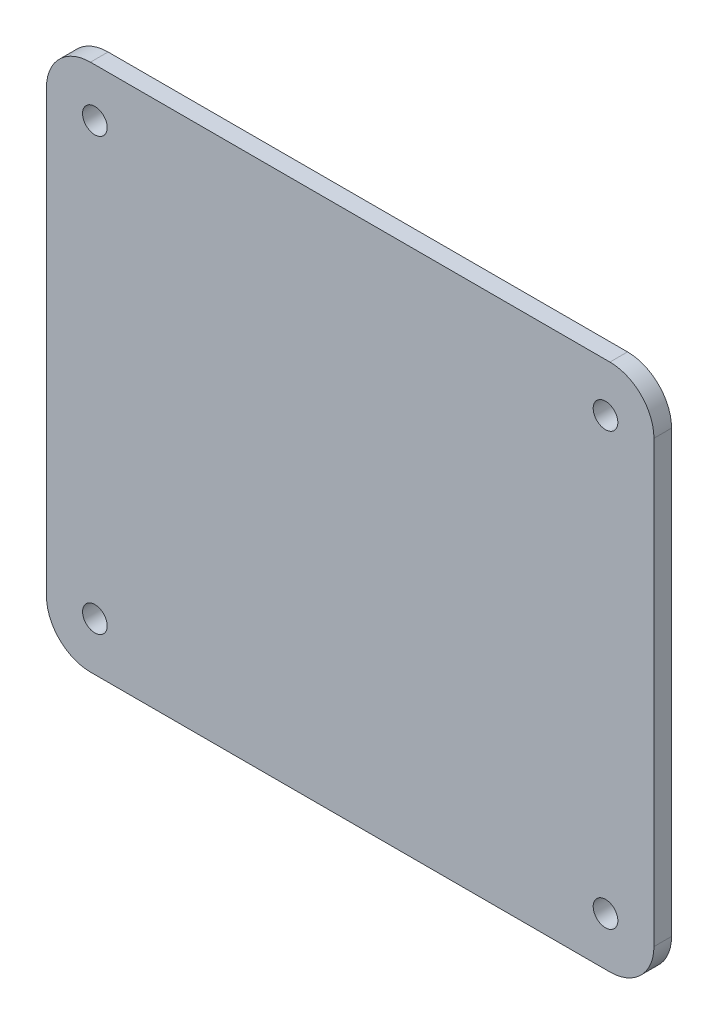
from build123d import *

# Parameters (mm, degrees)
BOSS_EXTRUDE1_DEPTH      = 6.5
SKETCH5_R                = 3
SKETCH5_R_2              = 1.4
BOSS_EXTRUDE5_DEPTH      = 3.2
BOSS_EXTRUDE5_2_DEPTH    = 3.2
BOSS_EXTRUDE5_3_DEPTH    = 3.2
BOSS_EXTRUDE5_4_DEPTH    = 3.2
BOSS_EXTRUDE6_START      = -1.5
BOSS_EXTRUDE6_DEPTH      = 1.5
CUT_EXTRUDE9_START       = -1.5
SKETCH17_R               = 1.4
CUT_EXTRUDE9_DEPTH       = 1.5
CUT_EXTRUDE10_DEPTH      = 10
CUT_EXTRUDE10_DEPTH_BACK = 4
SKETCH18_W               = 118.483225972
SKETCH18_H               = 113.092379331
SKETCH19_W               = 5
SKETCH19_H               = 5
BOSS_EXTRUDE9_DEPTH      = 7
SKETCH20_R               = 1.4
BOSS_EXTRUDE10_DEPTH     = 1.3


with BuildPart() as part:
    # Sketch3 → Boss-Extrude1 (new body)
    with BuildSketch(Plane.XY.offset(55.290865561)):
        with BuildLine():
            Line((-23.272824317, 59.357808031), (-23.272824317, 9.357808031))
            ThreePointArc((-23.272824317, 9.357808031), (-21.808358223, 5.822274126), (-18.272824317, 4.357808031))
            Line((-18.272824317, 4.357808031), (40.727175683, 4.357808031))
            ThreePointArc((40.727175683, 4.357808031), (44.262709589, 5.822274126), (45.727175683, 9.357808031))
            Line((45.727175683, 9.357808031), (45.727175683, 59.357808031))
            ThreePointArc((45.727175683, 59.357808031), (44.262709589, 62.893341937), (40.727175683, 64.357808031))
            Line((40.727175683, 64.357808031), (-18.272824317, 64.357808031))
            ThreePointArc((-18.272824317, 64.357808031), (-21.808358223, 62.893341937), (-23.272824317, 59.357808031))
        make_face()
        with BuildLine():
            Line((40.727175683, 62.857808031), (-18.272824317, 62.857808031))
            ThreePointArc((-18.272824317, 62.857808031), (-20.747698051, 61.832681766), (-21.772824317, 59.357808031))
            Line((-21.772824317, 59.357808031), (-21.772824317, 9.357808031))
            ThreePointArc((-21.772824317, 9.357808031), (-20.747698051, 6.882934297), (-18.272824317, 5.857808031))
            Line((-18.272824317, 5.857808031), (40.727175683, 5.857808031))
            ThreePointArc((40.727175683, 5.857808031), (43.202049418, 6.882934297), (44.227175683, 9.357808031))
            Line((44.227175683, 9.357808031), (44.227175683, 59.357808031))
            ThreePointArc((44.227175683, 59.357808031), (43.202049418, 61.832681766), (40.727175683, 62.857808031))
        make_face(mode=Mode.SUBTRACT)
    extrude(amount=BOSS_EXTRUDE1_DEPTH)



with BuildPart() as body_2:
    # Sketch5 → Boss-Extrude5 (new body)
    with BuildSketch(Plane.XY.offset(55.290865561)):
        with Locations((-17.772824317, 58.857808031)):
            Circle(SKETCH5_R)
        with Locations(Location((-17.772824317, 58.857808031, 0), (0, 0, 180))):
            Circle(SKETCH5_R_2, mode=Mode.SUBTRACT)
    extrude(amount=BOSS_EXTRUDE5_DEPTH)


with BuildPart() as body_3:
    # Sketch5 → Boss-Extrude5 2 (new body)
    with BuildSketch(Plane.XY.offset(55.290865561)):
        with Locations(Location((40.227175683, 58.857808031, 0), (0, 0, 180))):
            Circle(SKETCH5_R)
        with Locations((40.227175683, 58.857808031)):
            Circle(SKETCH5_R_2, mode=Mode.SUBTRACT)
    extrude(amount=BOSS_EXTRUDE5_2_DEPTH)


with BuildPart() as body_4:
    # Sketch5 → Boss-Extrude5 3 (new body)
    with BuildSketch(Plane.XY.offset(55.290865561)):
        with Locations(Location((-17.772824317, 9.857808031, 0), (0, 0, 180))):
            Circle(SKETCH5_R)
        with Locations((-17.772824317, 9.857808031)):
            Circle(SKETCH5_R_2, mode=Mode.SUBTRACT)
    extrude(amount=BOSS_EXTRUDE5_3_DEPTH)


with BuildPart() as body_5:
    # Sketch5 → Boss-Extrude5 4 (new body)
    with BuildSketch(Plane.XY.offset(55.290865561)):
        with Locations((40.227175683, 9.857808031)):
            Circle(SKETCH5_R)
        with Locations(Location((40.227175683, 9.857808031, 0), (0, 0, 180))):
            Circle(SKETCH5_R_2, mode=Mode.SUBTRACT)
    extrude(amount=BOSS_EXTRUDE5_4_DEPTH)


with BuildPart() as part_1:
    add(part.part)

    add(body_2.part)  # Boss-Extrude6 merges body 2

    add(body_3.part)  # Boss-Extrude6 merges body 3

    add(body_4.part)  # Boss-Extrude6 merges body 4

    add(body_5.part)  # Boss-Extrude6 merges body 5
    # Sketch13 → Boss-Extrude6 (add)
    with BuildSketch(Plane.XY.offset(55.290865561).offset(BOSS_EXTRUDE6_START)):
        with BuildLine():
            Line((-23.272824317, 26.657808031), (-23.272824317, 42.657808031))
            Line((-23.272824317, 42.657808031), (-23.272824317, 59.357808031))
            ThreePointArc((-23.272824317, 59.357808031), (-21.808358223, 62.893341937), (-18.272824317, 64.357808031))
            Line((-18.272824317, 64.357808031), (40.727175683, 64.357808031))
            ThreePointArc((40.727175683, 64.357808031), (44.262709589, 62.893341937), (45.727175683, 59.357808031))
            Line((45.727175683, 59.357808031), (45.727175683, 9.357808031))
            ThreePointArc((45.727175683, 9.357808031), (44.262709589, 5.822274126), (40.727175683, 4.357808031))
            Line((40.727175683, 4.357808031), (-18.272824317, 4.357808031))
            ThreePointArc((-18.272824317, 4.357808031), (-21.808358223, 5.822274126), (-23.272824317, 9.357808031))
            Line((-23.272824317, 9.357808031), (-23.272824317, 26.657808031))
        make_face()
    extrude(amount=BOSS_EXTRUDE6_DEPTH)

    # Sketch17 → Cut-Extrude9 (cut)
    with BuildSketch(Plane.XY.offset(55.290865561).offset(CUT_EXTRUDE9_START)):
        with Locations(Location((40.227175683, 9.857808031, 0), (0, 0, 180))):
            Circle(SKETCH17_R)
        with Locations(Location((-17.772824317, 9.857808031, 0), (0, 0, 180))):
            Circle(SKETCH17_R)
        with Locations(Location((-17.772824317, 58.857808031, 0), (0, 0, 180))):
            Circle(SKETCH17_R)
        with Locations(Location((40.227175683, 58.857808031, 0), (0, 0, 180))):
            Circle(SKETCH17_R)
    extrude(amount=CUT_EXTRUDE9_DEPTH, mode=Mode.SUBTRACT)

    # Sketch18 → Cut-Extrude10 (cut, two sides: drawn at the far end of the back side and taken through both)
    with BuildSketch(Plane.XY.offset(58.490865561).offset(-CUT_EXTRUDE10_DEPTH_BACK)):
        with Locations((8.738192824, 45.025275568)):
            Rectangle(SKETCH18_W, SKETCH18_H)
    extrude(amount=CUT_EXTRUDE10_DEPTH + CUT_EXTRUDE10_DEPTH_BACK, mode=Mode.SUBTRACT)

    # Sketch19 → Boss-Extrude9 (add)
    with BuildSketch(Plane(origin=(0, 0, 53.790865561), x_dir=(-1, 0, 0), z_dir=(0, 0, -1))):
        with Locations((-33.227175683, 51.857808031)):
            Rectangle(SKETCH19_W, SKETCH19_H)
        with Locations((10.772824317, 16.857808031)):
            Rectangle(SKETCH19_W, SKETCH19_H)
        with Locations((10.772824317, 51.857808031)):
            Rectangle(SKETCH19_W, SKETCH19_H)
        with Locations((-33.227175683, 16.857808031)):
            Rectangle(SKETCH19_W, SKETCH19_H)
    extrude(amount=BOSS_EXTRUDE9_DEPTH)

    # Sketch20 → Boss-Extrude10 (add)
    with BuildSketch(Plane.XY.offset(54.490865561)):
        with BuildLine():
            Line((40.727175683, 64.357808031), (-18.272824317, 64.357808031))
            ThreePointArc((-18.272824317, 64.357808031), (-21.808358223, 62.893341937), (-23.272824317, 59.357808031))
            Line((-23.272824317, 59.357808031), (-23.272824317, 9.357808031))
            ThreePointArc((-23.272824317, 9.357808031), (-21.808358223, 5.822274126), (-18.272824317, 4.357808031))
            Line((-18.272824317, 4.357808031), (40.727175683, 4.357808031))
            ThreePointArc((40.727175683, 4.357808031), (44.262709589, 5.822274126), (45.727175683, 9.357808031))
            Line((45.727175683, 9.357808031), (45.727175683, 59.357808031))
            ThreePointArc((45.727175683, 59.357808031), (44.262709589, 62.893341937), (40.727175683, 64.357808031))
        make_face()
        with Locations(Location((-17.772824317, 9.857808031, 0), (0, 0, 180))):
            Circle(SKETCH20_R, mode=Mode.SUBTRACT)
        with Locations((-17.772824317, 58.857808031)):
            Circle(SKETCH20_R, mode=Mode.SUBTRACT)
        with Locations(Location((40.227175683, 58.857808031, 0), (0, 0, 180))):
            Circle(SKETCH20_R, mode=Mode.SUBTRACT)
        with Locations((40.227175683, 9.857808031)):
            Circle(SKETCH20_R, mode=Mode.SUBTRACT)
    extrude(amount=BOSS_EXTRUDE10_DEPTH)


solid = part_1.part
